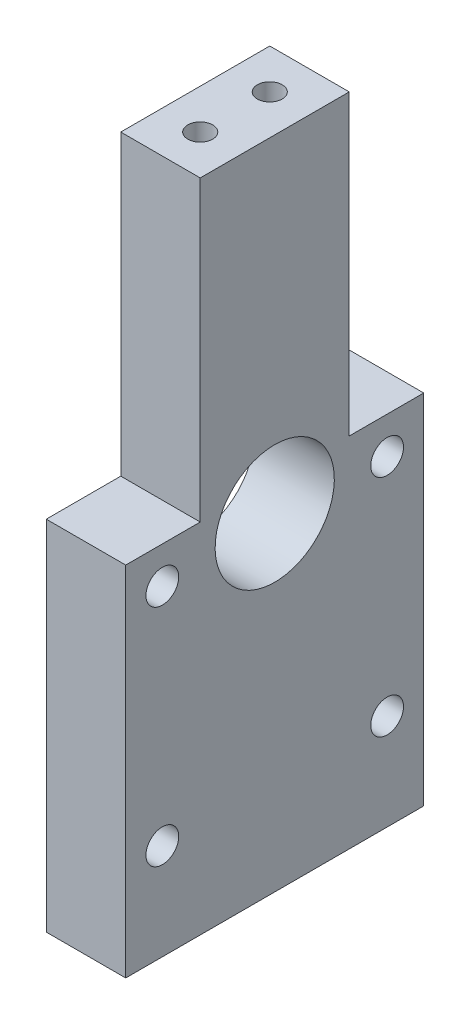
from build123d import *

# Parameters (mm, degrees)
SKETCH_1_W             = 8
SKETCH_1_H             = 66
EXTRUDE_1_DEPTH        = 30
SKETCH_7_R             = 1.5
CUT_EXTRUDE_2_DEPTH    = 5
HOLE_WIZARD_M4_2_D     = 3.3
HOLE_WIZARD_M4_2_DEPTH = 10.1
HOLE_WIZARD_M4_2_TIP   = 0.991420021
SKETCH_10_R            = 1
CUT_EXTRUDE_4_DEPTH    = 5
HOLE_WIZARD_M3_1_D     = 2.5
HOLE_WIZARD_M3_1_DEPTH = 10.5
HOLE_WIZARD_M3_1_TIP   = 0.751075774
SKETCH_12_R            = 1
CUT_EXTRUDE_5_DEPTH    = 5
HOLE_WIZARD_M3_2_D     = 2.5
HOLE_WIZARD_M3_2_DEPTH = 18.5
HOLE_WIZARD_M3_2_TIP   = 0.751075774
SKETCH_14_W            = 8
SKETCH_14_H            = 7.5
CUT_EXTRUDE_6_DEPTH    = 30
SKETCH_15_R            = 6
CUT_EXTRUDE_7_DEPTH    = 84.024092889


with BuildPart() as part:
    # 草图1 → 凸台-拉伸1 (new body)
    with BuildSketch(Plane.XY):
        with Locations((14, -44)):
            Rectangle(SKETCH_1_W, SKETCH_1_H)
    extrude(amount=EXTRUDE_1_DEPTH)

    # 草图7 → 切除-拉伸2 (cut)
    with BuildSketch(Plane.ZY.offset(-10)):
        with Locations(Location((26.313708499, -44.686291501, 0), (0, 0, 270))):
            Circle(SKETCH_7_R)
        with Locations(Location((3.686291501, -44.686291501, 0), (0, 0, 90))):
            Circle(SKETCH_7_R)
        with Locations(Location((26.313708499, -67.313708499, 0), (0, 0, 90))):
            Circle(SKETCH_7_R)
        with Locations(Location((3.686291501, -67.313708499, 0), (0, 0, 270))):
            Circle(SKETCH_7_R)
    extrude(amount=-CUT_EXTRUDE_2_DEPTH, mode=Mode.SUBTRACT)

    # M4 螺纹孔2
    with Locations(Plane(origin=(18, -44.686291501, 3.686291501), x_dir=(0, 1, 0), z_dir=(1, 0, 0))):
        with Locations((0, 0), (-22.627416998, 0), (-22.627416998, 22.627416998), (0, 22.627416998)):
            Hole(HOLE_WIZARD_M4_2_D / 2, depth=HOLE_WIZARD_M4_2_DEPTH)
            with Locations((0, 0, -(HOLE_WIZARD_M4_2_DEPTH + HOLE_WIZARD_M4_2_TIP / 2))):  # 118° drill point
                Cone(0, HOLE_WIZARD_M4_2_D / 2, HOLE_WIZARD_M4_2_TIP, mode=Mode.SUBTRACT)

    # 草图10 → 切除-拉伸4 (cut)
    with BuildSketch(Plane(origin=(0, -11, 0), x_dir=(1, 0, 0), z_dir=(0, 1, 0))):
        with Locations(Location((14, -11.5, 0), (0, 0, 270))):
            Circle(SKETCH_10_R)
        with Locations(Location((14, -18.5, 0), (0, 0, 270))):
            Circle(SKETCH_10_R)
    extrude(amount=-CUT_EXTRUDE_4_DEPTH, mode=Mode.SUBTRACT)

    # M3 螺纹孔1
    with Locations(Plane(origin=(14, -11, 11.5), x_dir=(0, 0, 1), z_dir=(0, 1, 0))):
        with Locations((0, 0), (7, 0)):
            Hole(HOLE_WIZARD_M3_1_D / 2, depth=HOLE_WIZARD_M3_1_DEPTH)
            with Locations((0, 0, -(HOLE_WIZARD_M3_1_DEPTH + HOLE_WIZARD_M3_1_TIP / 2))):  # 118° drill point
                Cone(0, HOLE_WIZARD_M3_1_D / 2, HOLE_WIZARD_M3_1_TIP, mode=Mode.SUBTRACT)

    # 草图12 → 切除-拉伸5 (cut)
    with BuildSketch(Plane.XZ.offset(77)):
        with Locations(Location((14, 20, 0), (0, 0, 270))):
            Circle(SKETCH_12_R)
        with Locations(Location((14, 10, 0), (0, 0, 270))):
            Circle(SKETCH_12_R)
    extrude(amount=-CUT_EXTRUDE_5_DEPTH, mode=Mode.SUBTRACT)

    # M3 螺纹孔2
    with Locations(Plane(origin=(14, -77, 20), x_dir=(0, 0, -1), z_dir=(0, -1, 0))):
        with Locations((0, 0), (10, 0)):
            Hole(HOLE_WIZARD_M3_2_D / 2, depth=HOLE_WIZARD_M3_2_DEPTH)
            with Locations((0, 0, -(HOLE_WIZARD_M3_2_DEPTH + HOLE_WIZARD_M3_2_TIP / 2))):  # 118° drill point
                Cone(0, HOLE_WIZARD_M3_2_D / 2, HOLE_WIZARD_M3_2_TIP, mode=Mode.SUBTRACT)

    # 草图14 → 切除-拉伸6 (cut)
    with BuildSketch(Plane(origin=(0, -11, 0), x_dir=(1, 0, 0), z_dir=(0, 1, 0))):
        with Locations((14, -3.75)):
            Rectangle(SKETCH_14_W, SKETCH_14_H)
        with Locations((14, -26.25)):
            Rectangle(SKETCH_14_W, SKETCH_14_H)
    extrude(amount=-CUT_EXTRUDE_6_DEPTH, mode=Mode.SUBTRACT)

    # 草图15 → 切除-拉伸7 (cut, through all)
    with BuildSketch(Plane(origin=(18, 0, 0), x_dir=(0, 0, -1), z_dir=(1, 0, 0))):
        with Locations(Location((-15, -44, 0), (0, 0, 90))):
            Circle(SKETCH_15_R)
    extrude(amount=-CUT_EXTRUDE_7_DEPTH, mode=Mode.SUBTRACT)


solid = part.part
